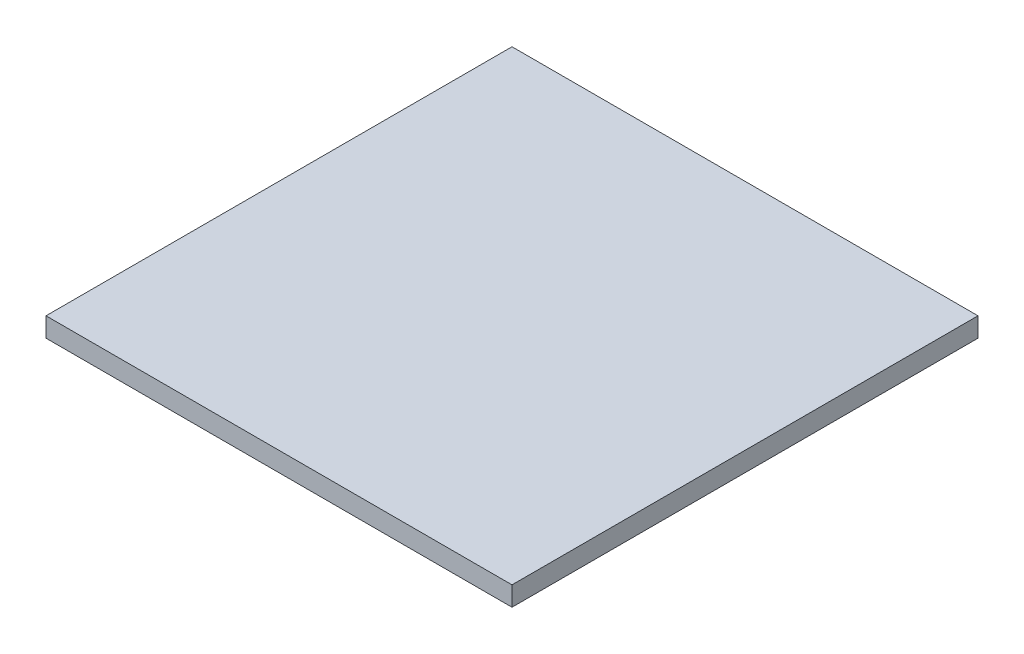
from build123d import *

# Parameters (mm, degrees)
SKETCH1_W           = 304.8
SKETCH1_H           = 304.8
BOSS_EXTRUDE1_DEPTH = 12.7


with BuildPart() as part:
    # Sketch1 → Boss-Extrude1 (new body)
    with BuildSketch(Plane(origin=(0, 0, 0), x_dir=(1, 0, 0), z_dir=(0, 1, 0))):
        with Locations((-100.020384491, -122.984846463)):
            Rectangle(SKETCH1_W, SKETCH1_H)
    extrude(amount=BOSS_EXTRUDE1_DEPTH)


solid = part.part
